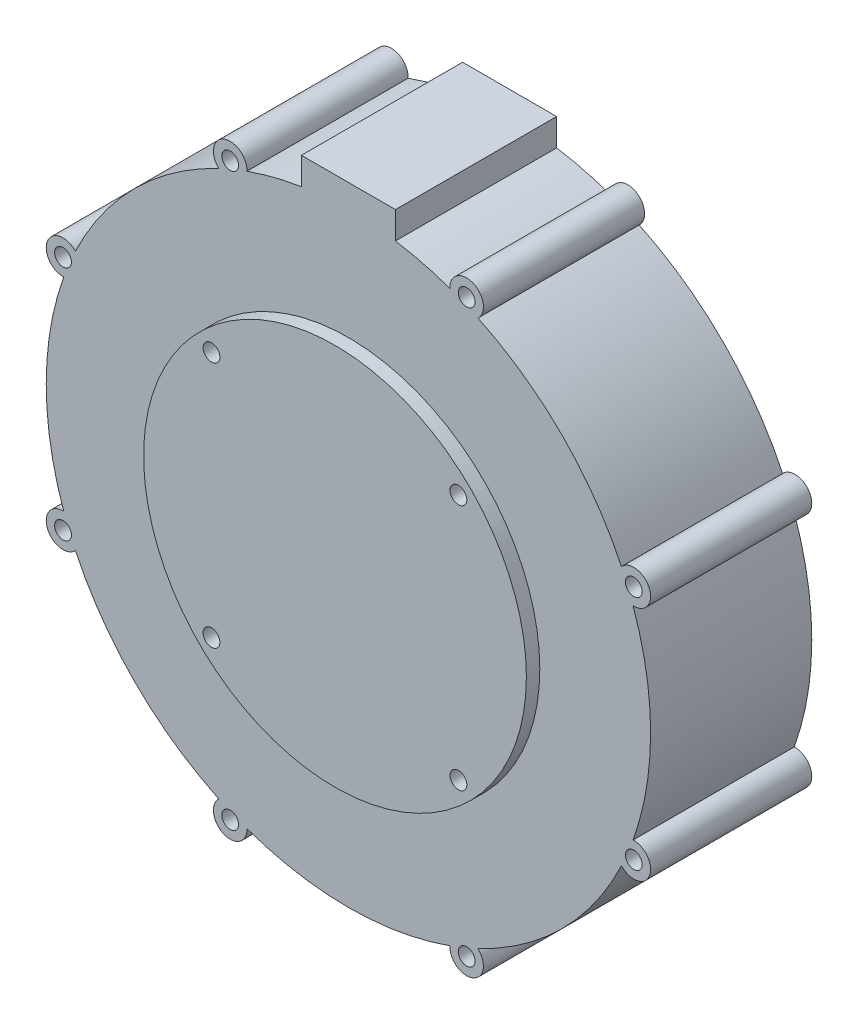
from build123d import *

# Parameters (mm, degrees)
SKETCH1_R              = 45
THAN_CHINH_DEPTH       = 24
SKETCH2_R              = 2.5
VAU_BAT_VIT_DEPTH      = 24
SKETCH3_W              = 14
SKETCH3_H              = 7.5
TAI_RA_DAY_DEPTH       = 24
SKETCH4_R              = 1.25
F_8XM3_MAT_SAU_DEPTH   = 6
F_8XM3_MAT_TRUOC_START = -6
SKETCH5_R              = 1.25
F_8XM3_MAT_TRUOC_DEPTH = 6
SKETCH6_R              = 28.5
ONG_SAU_D57_DEPTH      = 2
SKETCH8_R              = 1.25
F_4XM3_ONG_SAU_DEPTH   = 5
SKETCH9_R              = 30
BAC_D60_DEPTH          = 0.7
SKETCH10_R             = 25
GO_DINH_VI_D50_DEPTH   = 4.1
SKETCH11_R             = 1.25
F_6XM3_DAU_RA_DEPTH    = 5
SKETCH12_R             = 2
F_3XCHOT_D4_DEPTH      = 3.5


with BuildPart() as part:
    # Sketch1 → Than_chinh (new body)
    with BuildSketch(Plane.XY):
        Circle(SKETCH1_R)
    extrude(amount=THAN_CHINH_DEPTH)

    # Sketch2 → Vau_bat_vit (add)
    with BuildSketch(Plane.XY):
        with Locations((42.498458496, 17.603437889)):
            Circle(SKETCH2_R)
        with Locations((17.603437889, 42.498458496)):
            Circle(SKETCH2_R)
        with Locations((-17.603437889, 42.498458496)):
            Circle(SKETCH2_R)
        with Locations((-42.498458496, 17.603437889)):
            Circle(SKETCH2_R)
        with Locations((-42.498458496, -17.603437889)):
            Circle(SKETCH2_R)
        with Locations((-17.603437889, -42.498458496)):
            Circle(SKETCH2_R)
        with Locations((17.603437889, -42.498458496)):
            Circle(SKETCH2_R)
        with Locations((42.498458496, -17.603437889)):
            Circle(SKETCH2_R)
    extrude(amount=VAU_BAT_VIT_DEPTH)

    # Sketch3 → Tai_ra_day (add)
    with BuildSketch(Plane.XY):
        with Locations((0, 44.75)):
            Rectangle(SKETCH3_W, SKETCH3_H)
    extrude(amount=TAI_RA_DAY_DEPTH)

    # Sketch4 → 8xM3_mat_sau (cut)
    with BuildSketch(Plane.XY.offset(24)):
        with Locations((42.498458496, 17.603437889)):
            Circle(SKETCH4_R)
        with Locations((17.603437889, 42.498458496)):
            Circle(SKETCH4_R)
        with Locations((-17.603437889, 42.498458496)):
            Circle(SKETCH4_R)
        with Locations((-42.498458496, 17.603437889)):
            Circle(SKETCH4_R)
        with Locations((-42.498458496, -17.603437889)):
            Circle(SKETCH4_R)
        with Locations((-17.603437889, -42.498458496)):
            Circle(SKETCH4_R)
        with Locations((17.603437889, -42.498458496)):
            Circle(SKETCH4_R)
        with Locations((42.498458496, -17.603437889)):
            Circle(SKETCH4_R)
    extrude(amount=-F_8XM3_MAT_SAU_DEPTH, mode=Mode.SUBTRACT)

    # Sketch5 → 8xM3_mat_truoc (cut)
    with BuildSketch(Plane(origin=(0, 0, 0), x_dir=(-1, 0, 0), z_dir=(0, 0, -1)).offset(F_8XM3_MAT_TRUOC_START)):
        with Locations(Location((-42.498458496, 17.603437889, 0), (0, 0, 180))):
            Circle(SKETCH5_R)
        with Locations(Location((-17.603437889, 42.498458496, 0), (0, 0, 180))):
            Circle(SKETCH5_R)
        with Locations(Location((17.603437889, 42.498458496, 0), (0, 0, 180))):
            Circle(SKETCH5_R)
        with Locations(Location((42.498458496, 17.603437889, 0), (0, 0, 180))):
            Circle(SKETCH5_R)
        with Locations(Location((42.498458496, -17.603437889, 0), (0, 0, 180))):
            Circle(SKETCH5_R)
        with Locations(Location((17.603437889, -42.498458496, 0), (0, 0, 180))):
            Circle(SKETCH5_R)
        with Locations(Location((-17.603437889, -42.498458496, 0), (0, 0, 180))):
            Circle(SKETCH5_R)
        with Locations(Location((-42.498458496, -17.603437889, 0), (0, 0, 180))):
            Circle(SKETCH5_R)
    extrude(amount=F_8XM3_MAT_TRUOC_DEPTH, mode=Mode.SUBTRACT)

    # Sketch6 → Ong_sau_D57 (add)
    with BuildSketch(Plane.XY.offset(24)):
        Circle(SKETCH6_R)
    extrude(amount=ONG_SAU_D57_DEPTH)

    # Sketch8 → 4xM3_ong_sau (cut)
    with BuildSketch(Plane.XY.offset(26)):
        with Locations((18.384776311, 18.384776311)):
            Circle(SKETCH8_R)
        with Locations((-18.384776311, 18.384776311)):
            Circle(SKETCH8_R)
        with Locations((-18.384776311, -18.384776311)):
            Circle(SKETCH8_R)
        with Locations((18.384776311, -18.384776311)):
            Circle(SKETCH8_R)
    extrude(amount=-F_4XM3_ONG_SAU_DEPTH, mode=Mode.SUBTRACT)

    # Sketch9 → Bac_D60 (add)
    with BuildSketch(Plane(origin=(0, 0, 0), x_dir=(-1, 0, 0), z_dir=(0, 0, -1))):
        with Locations(Location((0, 0, 0), (0, 0, 180))):
            Circle(SKETCH9_R)
    extrude(amount=BAC_D60_DEPTH)

    # Sketch10 → Go_dinh_vi_D50 (add)
    with BuildSketch(Plane(origin=(0, 0, 0), x_dir=(-1, 0, 0), z_dir=(0, 0, -1))):
        Circle(SKETCH10_R)
    extrude(amount=GO_DINH_VI_D50_DEPTH)

    # Sketch11 → 6xM3_dau_ra (cut)
    with BuildSketch(Plane(origin=(0, 0, -4.1), x_dir=(-1, 0, 0), z_dir=(0, 0, -1))):
        with Locations((-12.5, 0)):
            Circle(SKETCH11_R)
        with Locations((-6.25, 10.825317547)):
            Circle(SKETCH11_R)
        with Locations((6.25, 10.825317547)):
            Circle(SKETCH11_R)
        with Locations((12.5, 0)):
            Circle(SKETCH11_R)
        with Locations((6.25, -10.825317547)):
            Circle(SKETCH11_R)
        with Locations((-6.25, -10.825317547)):
            Circle(SKETCH11_R)
    extrude(amount=-F_6XM3_DAU_RA_DEPTH, mode=Mode.SUBTRACT)

    # Sketch12 → 3xChot_D4 (add)
    with BuildSketch(Plane(origin=(0, 0, -4.1), x_dir=(-1, 0, 0), z_dir=(0, 0, -1))):
        with Locations((0, 10.2)):
            Circle(SKETCH12_R)
        with Locations((8.833459119, -5.1)):
            Circle(SKETCH12_R)
        with Locations((-8.833459119, -5.1)):
            Circle(SKETCH12_R)
    extrude(amount=F_3XCHOT_D4_DEPTH)


solid = part.part
